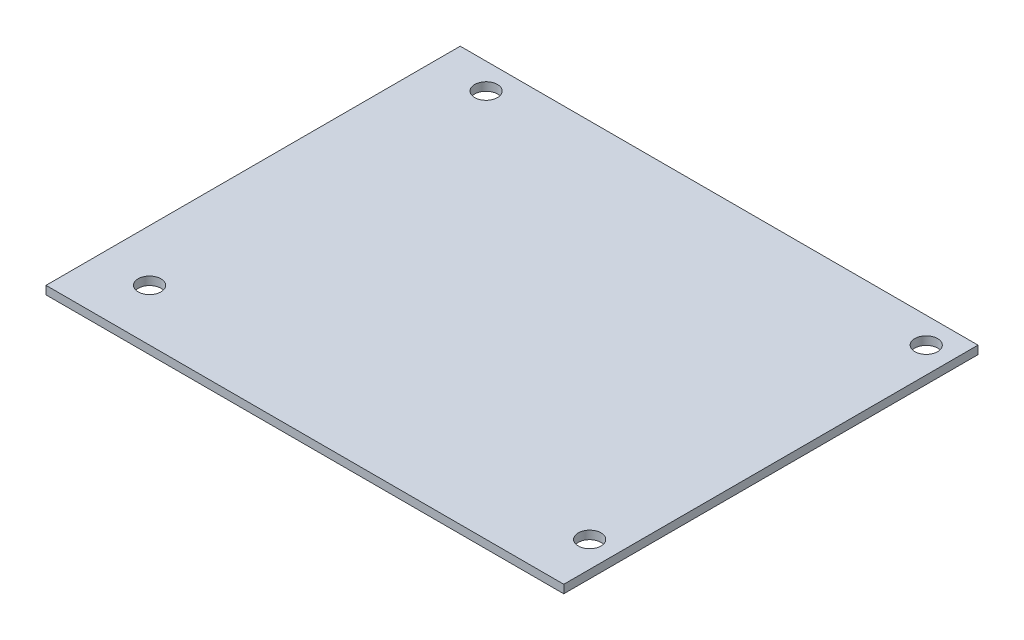
from build123d import *

# Parameters (mm, degrees)
SKETCH1_W           = 100
SKETCH1_H           = 80
BOSS_EXTRUDE1_DEPTH = 1.6
SKETCH2_R           = 2.2
CUT_EXTRUDE1_DEPTH  = 65.051229496


with BuildPart() as part:
    # Sketch1 → Boss-Extrude1 (new body)
    with BuildSketch(Plane(origin=(0, 0, 0), x_dir=(1, 0, 0), z_dir=(0, 1, 0))):
        Rectangle(SKETCH1_W, SKETCH1_H)
    extrude(amount=BOSS_EXTRUDE1_DEPTH)

    # Sketch2 → Cut-Extrude1 (cut, through all)
    with BuildSketch(Plane(origin=(0, 1.6, 0), x_dir=(1, 0, 0), z_dir=(0, 1, 0))):
        with Locations(Location((-40, -30, 0), (0, 0, 270))):
            Circle(SKETCH2_R)
        with Locations(Location((-40, 35, 0), (0, 0, 270))):
            Circle(SKETCH2_R)
        with Locations(Location((45, 35, 0), (0, 0, 270))):
            Circle(SKETCH2_R)
        with Locations(Location((45, -30, 0), (0, 0, 270))):
            Circle(SKETCH2_R)
    extrude(amount=-CUT_EXTRUDE1_DEPTH, mode=Mode.SUBTRACT)


solid = part.part
